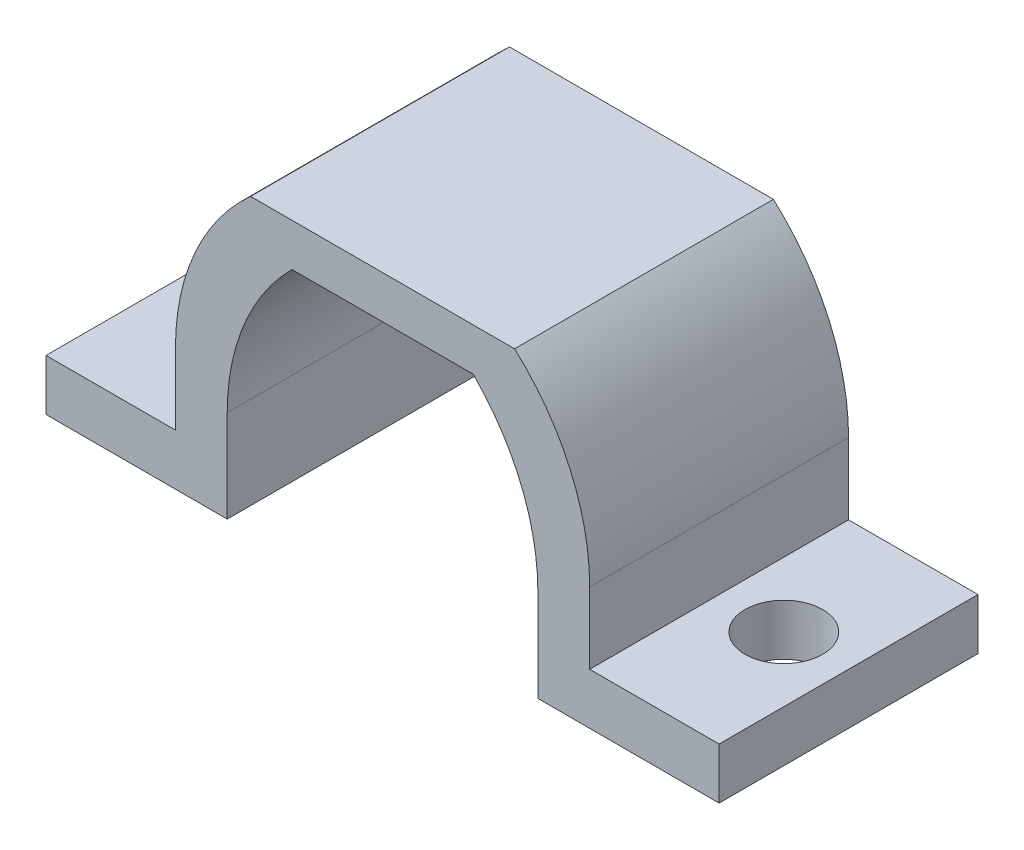
from build123d import *

# Parameters (mm, degrees)
RESSALTO_EXTRUS_O1_DEPTH = 10
ESBO_O3_R                = 1.5
CORTE_EXTRUS_O1_DEPTH    = 10


with BuildPart() as part:
    # Esboço2 → Ressalto-extrusão1 (new body)
    with BuildSketch(Plane.XY):
        with BuildLine():
            Line((-2.16273614, 4.130820826), (4.83726386, 4.130820826))
            ThreePointArc((4.83726386, 4.130820826), (6.687556539, 1.360164653), (7.33726386, -1.907556116))
            Line((7.33726386, -1.907556116), (7.33726386, -5.469179174))
            Line((7.33726386, -5.469179174), (14.33726386, -5.469179174))
            Line((14.33726386, -5.469179174), (14.33726386, -3.493237638))
            Line((14.33726386, -3.493237638), (9.33726386, -3.493237638))
            Line((9.33726386, -3.493237638), (9.33726386, -0.739966657))
            ThreePointArc((9.33726386, -0.739966657), (8.579234613, 2.826995847), (6.436166726, 5.777434776))
            Line((6.436166726, 5.777434776), (-3.761639005, 5.777434776))
            ThreePointArc((-3.761639005, 5.777434776), (-5.904706893, 2.826995847), (-6.66273614, -0.739966657))
            Line((-6.66273614, -0.739966657), (-6.66273614, -3.493237638))
            Line((-6.66273614, -3.493237638), (-11.66273614, -3.493237638))
            Line((-11.66273614, -3.493237638), (-11.66273614, -5.469179174))
            Line((-11.66273614, -5.469179174), (-4.66273614, -5.469179174))
            Line((-4.66273614, -5.469179174), (-4.66273614, -1.907556116))
            ThreePointArc((-4.66273614, -1.907556116), (-4.013028819, 1.360164653), (-2.16273614, 4.130820826))
        make_face()
    extrude(amount=RESSALTO_EXTRUS_O1_DEPTH)

    # Esboço3 → Corte-extrusão1 (cut)
    with BuildSketch(Plane(origin=(0, -3.493237638, 0), x_dir=(1, 0, 0), z_dir=(0, 1, 0))):
        with Locations(Location((-9.16273614, -5, 0), (0, 0, 270))):
            Circle(ESBO_O3_R)
        with Locations(Location((11.83726386, -5, 0), (0, 0, 180))):
            Circle(ESBO_O3_R)
    extrude(amount=-CORTE_EXTRUS_O1_DEPTH, mode=Mode.SUBTRACT)


solid = part.part
